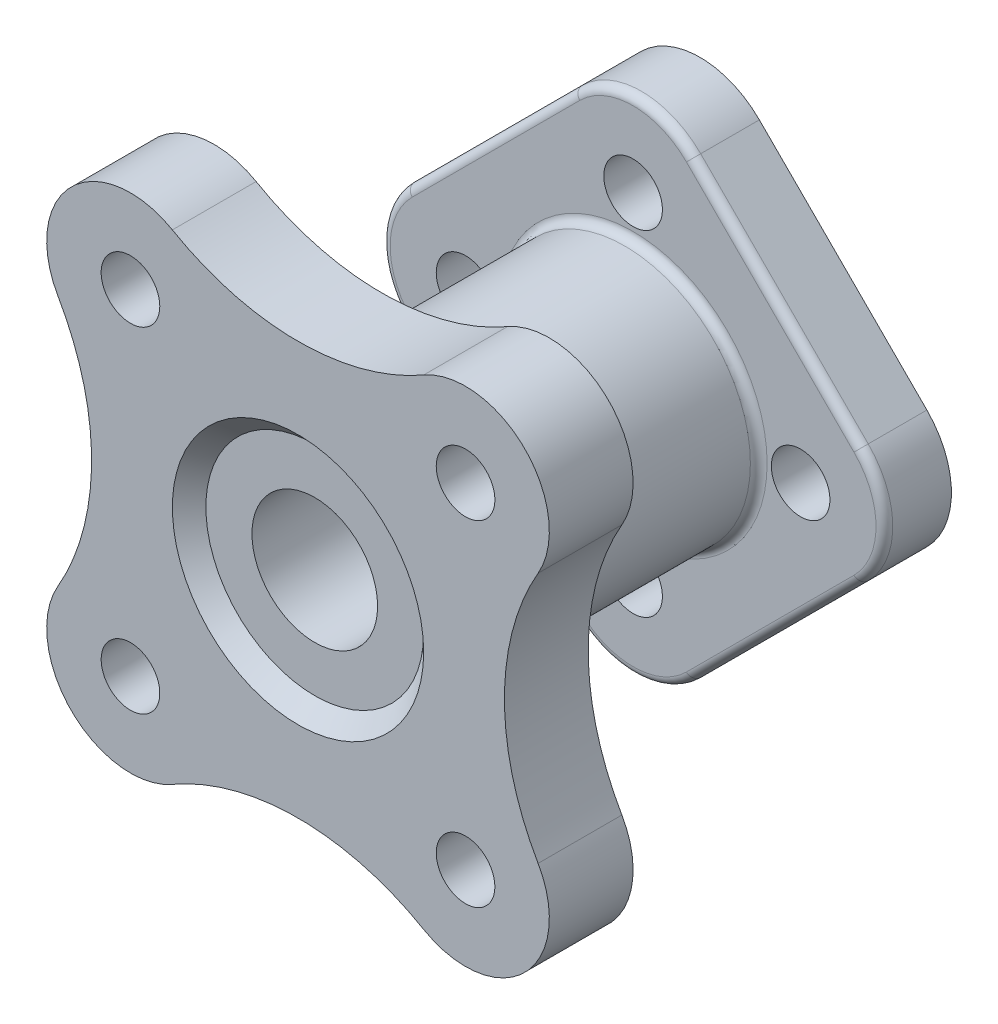
from build123d import *

# Parameters (mm, degrees)
SKETCH1_R           = 0.175
BOSS_EXTRUDE1_DEPTH = 0.5
SKETCH2_R           = 0.75
CUT_EXTRUDE1_DEPTH  = 0.1
CUT_EXTRUDE1_DRAFT  = -45
SKETCH3_R           = 0.75
BOSS_EXTRUDE2_DEPTH = 1.5
SKETCH4_R           = 0.175
BOSS_EXTRUDE3_DEPTH = 0.4
SKETCH5_R           = 0.375
CUT_EXTRUDE2_DEPTH  = 4.128897569
FILLET1_R           = 0.05


with BuildPart() as part:
    # Sketch1 → Boss-Extrude1 (new body)
    with BuildSketch(Plane.XY):
        with BuildLine():
            ThreePointArc((0.75, 1.433012702), (0, 1.232050808), (-0.75, 1.433012702))
            ThreePointArc((-0.75, 1.433012702), (-1.353553391, 1.353553391), (-1.433012702, 0.75))
            ThreePointArc((-1.433012702, 0.75), (-1.232050808, 0), (-1.433012702, -0.75))
            ThreePointArc((-1.433012702, -0.75), (-1.353553391, -1.353553391), (-0.75, -1.433012702))
            ThreePointArc((-0.75, -1.433012702), (0, -1.232050808), (0.75, -1.433012702))
            ThreePointArc((0.75, -1.433012702), (1.353553391, -1.353553391), (1.433012702, -0.75))
            ThreePointArc((1.433012702, -0.75), (1.232050808, 0), (1.433012702, 0.75))
            ThreePointArc((1.433012702, 0.75), (1.353553391, 1.353553391), (0.75, 1.433012702))
        make_face()
        with Locations((-1, 1)):
            Circle(SKETCH1_R, mode=Mode.SUBTRACT)
        with Locations(Location((1, 1, 0), (0, 0, 180))):
            Circle(SKETCH1_R, mode=Mode.SUBTRACT)
        with Locations(Location((-1, -1, 0), (0, 0, 180))):
            Circle(SKETCH1_R, mode=Mode.SUBTRACT)
        with Locations((1, -1)):
            Circle(SKETCH1_R, mode=Mode.SUBTRACT)
    extrude(amount=BOSS_EXTRUDE1_DEPTH)


with BuildPart() as cut_extrude1_tool:
    # Sketch2 → Cut-Extrude1 (with draft: the straight prism first)
    with BuildSketch(Plane.XY.offset(0.5)):
        Circle(SKETCH2_R)
    extrude(amount=-CUT_EXTRUDE1_DEPTH)
    # Cut-Extrude1: the draft: its side faces are tilted about the plane it starts from
    cut_extrude1_sides = [cut_extrude1_tool.faces().sort_by_distance(p)[0] for p in [
        (-0.75, 0, 0.45),
    ]]
    draft(cut_extrude1_sides, Plane.XY.offset(0.5), CUT_EXTRUDE1_DRAFT)


with BuildPart() as part_1:
    add(part.part)

    # Cut-Extrude1: cut by cut_extrude1_tool
    add(cut_extrude1_tool.part, mode=Mode.SUBTRACT)

    # Sketch3 → Boss-Extrude2 (add)
    with BuildSketch(Plane(origin=(0, 0, 0), x_dir=(-1, 0, 0), z_dir=(0, 0, -1))):
        Circle(SKETCH3_R)
    extrude(amount=BOSS_EXTRUDE2_DEPTH)

    # Sketch4 → Boss-Extrude3 (add)
    with BuildSketch(Plane(origin=(0, 0, -1.5), x_dir=(-1, 0, 0), z_dir=(0, 0, -1))):
        with BuildLine():
            Line((-0.353553391, -1.353553391), (-1.353553391, -0.353553391))
            ThreePointArc((-1.353553391, -0.353553391), (-1.5, 0), (-1.353553391, 0.353553391))
            Line((-1.353553391, 0.353553391), (-0.353553391, 1.353553391))
            ThreePointArc((-0.353553391, 1.353553391), (0, 1.5), (0.353553391, 1.353553391))
            Line((0.353553391, 1.353553391), (1.353553391, 0.353553391))
            ThreePointArc((1.353553391, 0.353553391), (1.5, 0), (1.353553391, -0.353553391))
            Line((1.353553391, -0.353553391), (0.353553391, -1.353553391))
            ThreePointArc((0.353553391, -1.353553391), (0, -1.5), (-0.353553391, -1.353553391))
        make_face()
        with Locations((-1, 0)):
            Circle(SKETCH4_R, mode=Mode.SUBTRACT)
        with Locations((0, 1)):
            Circle(SKETCH4_R, mode=Mode.SUBTRACT)
        with Locations((1, 0)):
            Circle(SKETCH4_R, mode=Mode.SUBTRACT)
        with Locations((0, -1)):
            Circle(SKETCH4_R, mode=Mode.SUBTRACT)
    extrude(amount=BOSS_EXTRUDE3_DEPTH)

    # Sketch5 → Cut-Extrude2 (cut, through all)
    with BuildSketch(Plane.XY.offset(0.4)):
        Circle(SKETCH5_R)
    extrude(amount=-CUT_EXTRUDE2_DEPTH, mode=Mode.SUBTRACT)

    # Fillet1
    fillet1_edges = [part_1.edges().sort_by_distance(p)[0] for p in [
        (0.75, 0, -1.5),
        (1.5, 0, -1.5),
        (0.853553391, -0.853553391, -1.5),
        (0, -1.5, -1.5),
        (-0.853553391, -0.853553391, -1.5),
        (-1.5, 0, -1.5),
        (-0.853553391, 0.853553391, -1.5),
        (0, 1.5, -1.5),
        (0.853553391, 0.853553391, -1.5),
    ]]
    fillet(fillet1_edges, radius=FILLET1_R)


solid = part_1.part
